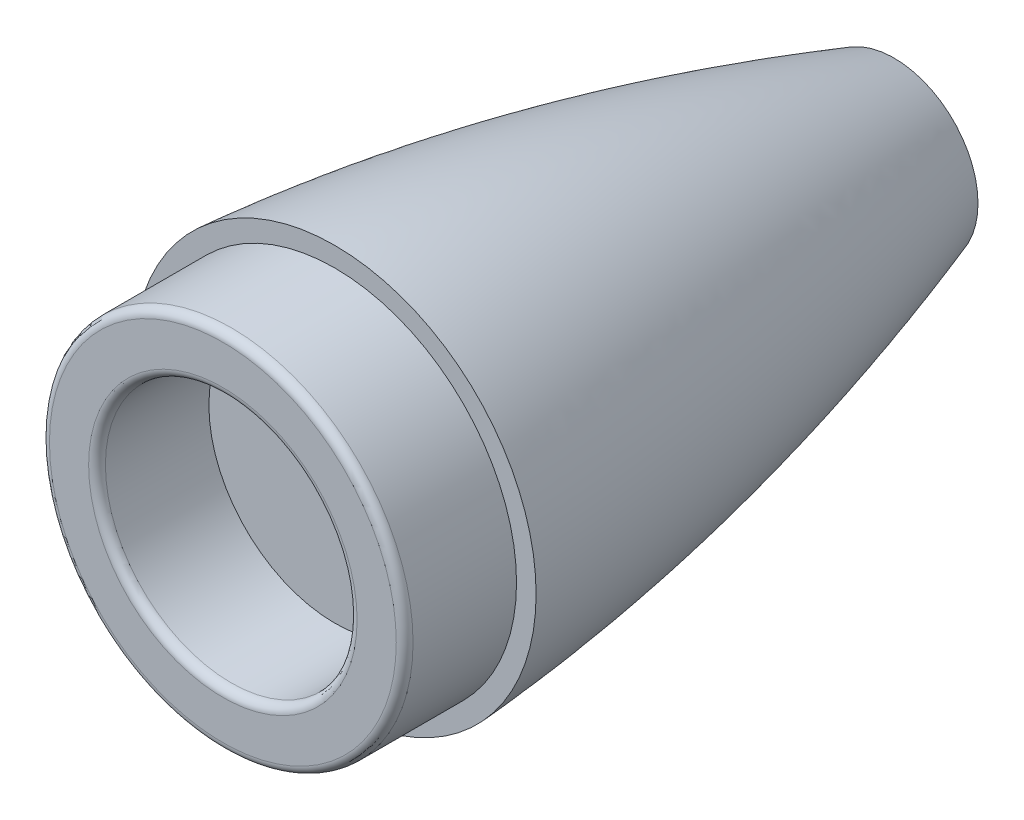
from build123d import *

# Parameters (mm, degrees)
SKETCH1_R           = 65
SKETCH1_R_2         = 45
BOSS_EXTRUDE1_DEPTH = 40
FILLET1_R           = 3
SKETCH4_R           = 10
CUT_EXTRUDE1_DEPTH  = 20


with BuildPart() as part:
    # Sketch1 → Boss-Extrude1 (new body)
    with BuildSketch(Plane.XY):
        Circle(SKETCH1_R)
        Circle(SKETCH1_R_2, mode=Mode.SUBTRACT)
    extrude(amount=-BOSS_EXTRUDE1_DEPTH)

    # Fillet1
    fillet1_edges = [part.edges().sort_by_distance(p)[0] for p in [
        (-65, 0, 0),
        (-45, 0, 0),
    ]]
    fillet(fillet1_edges, radius=FILLET1_R)

    # Sketch2 → Revolve1 (revolve)
    with BuildSketch(Plane(origin=(0, 0, 0), x_dir=(0, 0, -1), z_dir=(1, 0, 0))):
        with BuildLine():
            Line((40, 0), (240, 0))
            Line((240, 0), (240, 30))
            add(Edge.make_bspline(
                [(40, 72), (137.597263884, 64.854508863), (240, 30)],
                knots=[0, 0, 0, 1, 1, 1], degree=2))
            Line((40, 72), (40, 0))
        make_face()
    revolve(axis=Axis((0, 0, -40), (0, 0, -1)))

    # Sketch4 → Cut-Extrude1 (cut)
    with BuildSketch(Plane(origin=(0, 0, -240), x_dir=(-1, 0, 0), z_dir=(0, 0, -1))):
        Circle(SKETCH4_R)
    extrude(amount=-CUT_EXTRUDE1_DEPTH, mode=Mode.SUBTRACT)


solid = part.part
